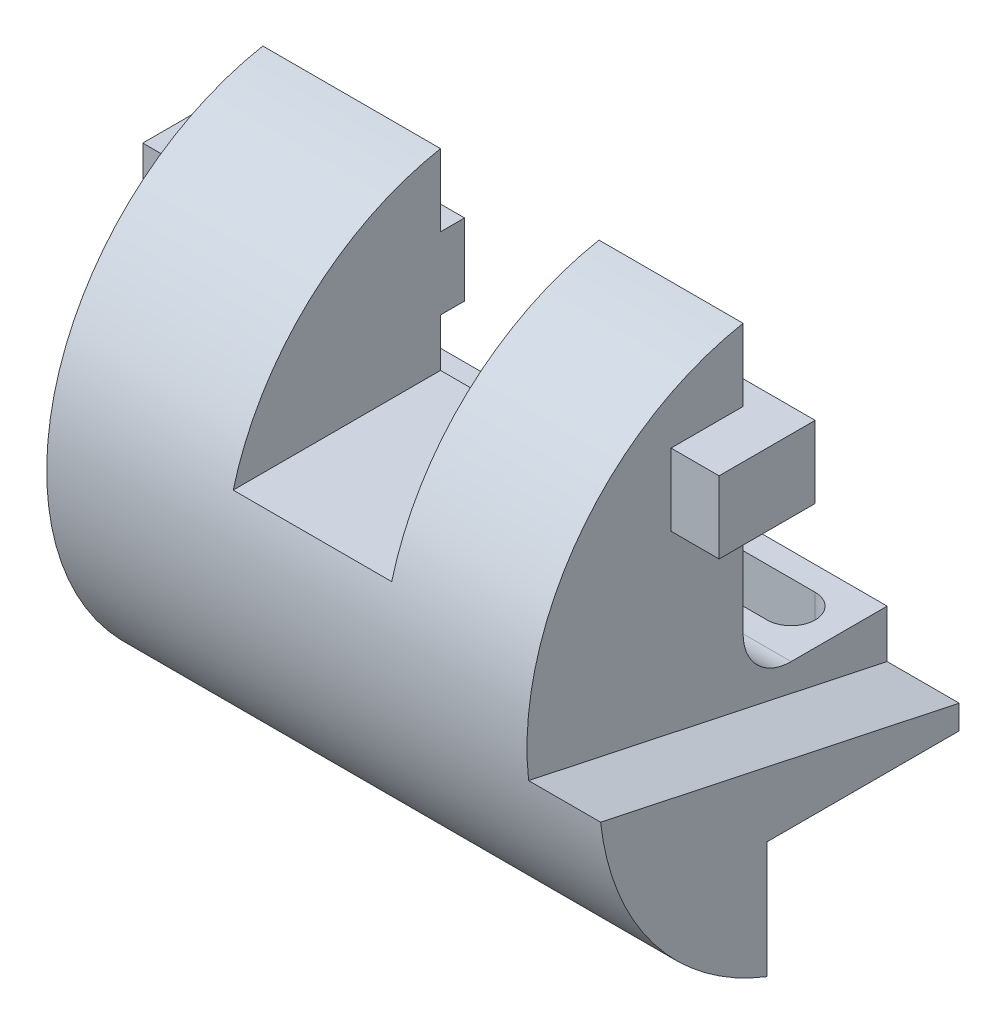
from build123d import *

# Parameters (mm, degrees)
BOSS_EXTRUDE1_DEPTH      = 115
CUT_EXTRUDE3_START       = -15
CUT_EXTRUDE3_DEPTH       = 15
CUT_EXTRUDE4_DEPTH       = 67
SKETCH5_W                = 33
SKETCH5_H                = 40
CUT_EXTRUDE5_DEPTH       = 67
SKETCH6_W                = 40
SKETCH6_H                = 15
BOSS_EXTRUDE2_DEPTH      = 5
SKETCH7_W                = 15
SKETCH7_H                = 15
BOSS_EXTRUDE4_DEPTH      = 10
SKETCH8_W                = 7
SKETCH8_H                = 15
BOSS_EXTRUDE5_DEPTH      = 5
BOSS_EXTRUDE6_DEPTH      = 5
BOSS_EXTRUDE6_DEPTH_BACK = 15
SKETCH9_W                = 40
SKETCH9_H                = 15


with BuildPart() as part:
    # Sketch1 → Boss-Extrude1 (new body)
    with BuildSketch(Plane(origin=(0, 0, 0), x_dir=(0, 0, -1), z_dir=(1, 0, 0))):
        with BuildLine():
            Line((-10, 54.083269132), (-10, -1.916730868))
            ThreePointArc((-10, -1.916730868), (-7.071067812, -8.98779868), (0, -11.916730868))
            Line((0, -11.916730868), (20, -11.916730868))
            Line((20, -11.916730868), (20, -26.916730868))
            Line((20, -26.916730868), (-20, -26.916730868))
            Line((-20, -26.916730868), (-20, -51.23475383))
            ThreePointArc((-20, -51.23475383), (-54.753734942, 5.198895061), (-10, 54.083269132))
        make_face()
    extrude(amount=BOSS_EXTRUDE1_DEPTH)

    # Sketch2 → Cut-Extrude3 (cut)
    with BuildSketch(Plane(origin=(115, 0, 0), x_dir=(0, 0, -1), z_dir=(1, 0, 0)).offset(CUT_EXTRUDE3_START)):
        with BuildLine():
            Line((20, -21.916730868), (-54.666698166, -6.045834235))
            ThreePointArc((-54.666698166, -6.045834235), (-45.878767393, 34.080884973), (-10, 54.083269132))
            Line((-10, 54.083269132), (-10, -1.916730868))
            ThreePointArc((-10, -1.916730868), (-7.071067812, -8.98779868), (0, -11.916730868))
            Line((0, -11.916730868), (20, -11.916730868))
            Line((20, -11.916730868), (20, -21.916730868))
        make_face()
    extrude(amount=CUT_EXTRUDE3_DEPTH, mode=Mode.SUBTRACT)

    # Sketch4 → Cut-Extrude4 (cut)
    with BuildSketch(Plane(origin=(0, -11.916730868, 0), x_dir=(1, 0, 0), z_dir=(0, 1, 0))):
        with BuildLine():
            Line((10, 15), (90, 15))
            ThreePointArc((90, 15), (95, 10), (90, 5))
            Line((90, 5), (10, 5))
            ThreePointArc((10, 5), (5, 10), (10, 15))
        make_face()
    extrude(amount=-CUT_EXTRUDE4_DEPTH, mode=Mode.SUBTRACT)

    # Sketch5 → Cut-Extrude5 (cut)
    with BuildSketch(Plane(origin=(0, 0, 10), x_dir=(-1, 0, 0), z_dir=(0, 0, -1))):
        with Locations((-53.5, 34.083269132)):
            Rectangle(SKETCH5_W, SKETCH5_H)
    extrude(amount=-CUT_EXTRUDE5_DEPTH, mode=Mode.SUBTRACT)

    # Sketch6 → Boss-Extrude2 (add)
    with BuildSketch(Plane(origin=(0, 0, 10), x_dir=(-1, 0, 0), z_dir=(0, 0, -1))):
        with Locations((-17, 31.583269132)):
            Rectangle(SKETCH6_W, SKETCH6_H)
    extrude(amount=BOSS_EXTRUDE2_DEPTH)

    # Sketch7 → Boss-Extrude4 (add)
    with BuildSketch(Plane.ZY):
        with Locations((17.5, 31.583269132)):
            Rectangle(SKETCH7_W, SKETCH7_H)
    extrude(amount=BOSS_EXTRUDE4_DEPTH)

    # Sketch8 → Boss-Extrude5 (add)
    with BuildSketch(Plane(origin=(0, 0, 10), x_dir=(-1, 0, 0), z_dir=(0, 0, -1))):
        with Locations((6.5, 31.583269132)):
            Rectangle(SKETCH8_W, SKETCH8_H)
    extrude(amount=BOSS_EXTRUDE5_DEPTH)

    # Sketch9 → Boss-Extrude6 (add, two sides: drawn at the far end of the back side and taken through both)
    with BuildSketch(Plane(origin=(0, 0, 10), x_dir=(-1, 0, 0), z_dir=(0, 0, -1)).offset(-BOSS_EXTRUDE6_DEPTH_BACK)):
        with Locations((-90, 31.583269132)):
            Rectangle(SKETCH9_W, SKETCH9_H)
    extrude(amount=BOSS_EXTRUDE6_DEPTH + BOSS_EXTRUDE6_DEPTH_BACK)


solid = part.part
